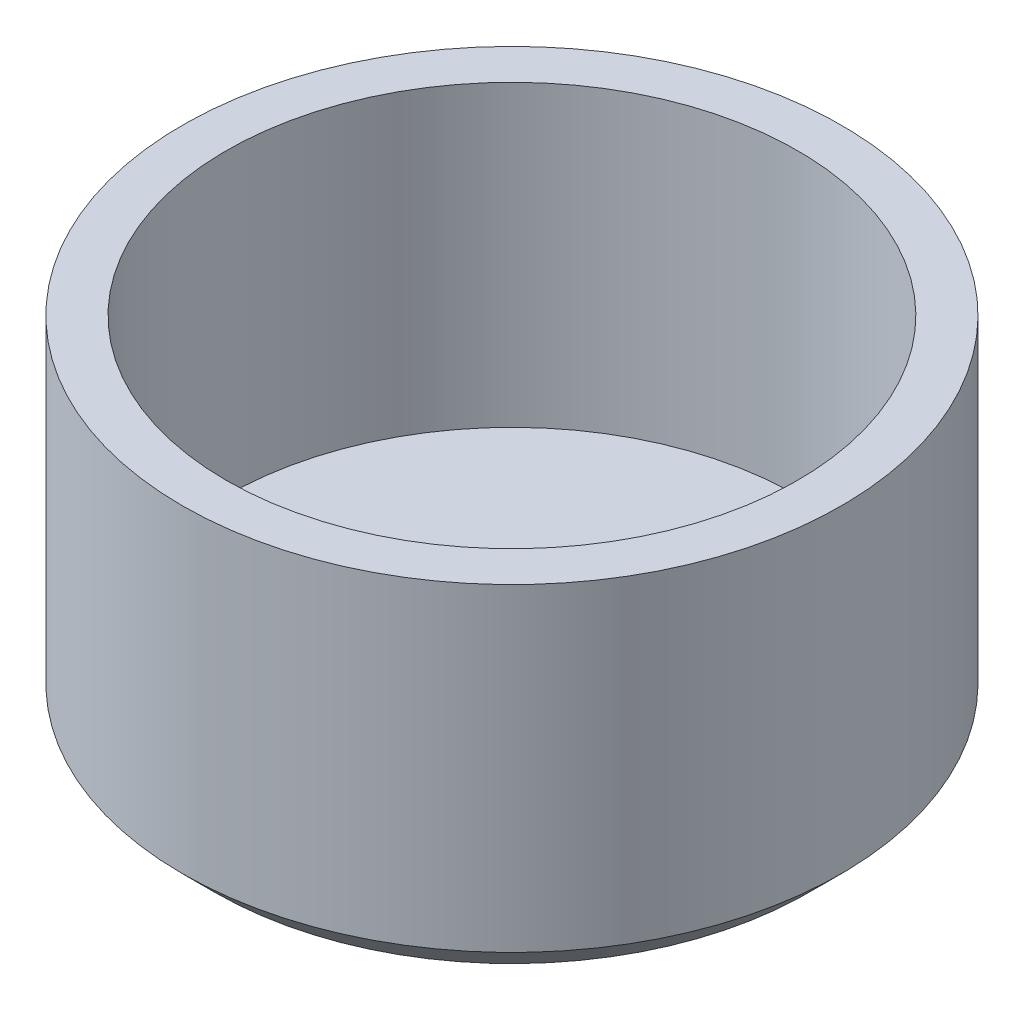
from build123d import *

# Parameters (mm, degrees)
SKETCH1_R           = 15
BOSS_EXTRUDE1_DEPTH = 16
SKETCH2_R           = 13
CUT_EXTRUDE1_DEPTH  = 13.6
CHAMFER1_SIZE       = 1.5


with BuildPart() as part:
    # Sketch1 → Boss-Extrude1 (new body)
    with BuildSketch(Plane(origin=(0, 0, 0), x_dir=(1, 0, 0), z_dir=(0, 1, 0))):
        with Locations(Location((0, 0, 0), (0, 0, 270))):
            Circle(SKETCH1_R)
        with BuildLine():
            Line((-1.268857754, 0.8), (1.268857754, 0.8))
            ThreePointArc((1.268857754, 0.8), (0, -1.5), (-1.268857754, 0.8))
        make_face(mode=Mode.SUBTRACT)
    extrude(amount=BOSS_EXTRUDE1_DEPTH)

    # Sketch2 → Cut-Extrude1 (cut)
    with BuildSketch(Plane(origin=(0, 16, 0), x_dir=(1, 0, 0), z_dir=(0, 1, 0))):
        with Locations(Location((0, 0, 0), (0, 0, 270))):
            Circle(SKETCH2_R)
    extrude(amount=-CUT_EXTRUDE1_DEPTH, mode=Mode.SUBTRACT)

    # Chamfer1
    chamfer1_edges = [part.edges().sort_by_distance(p)[0] for p in [
        (0, 0, -15),
    ]]
    chamfer(chamfer1_edges, length=CHAMFER1_SIZE)


solid = part.part
